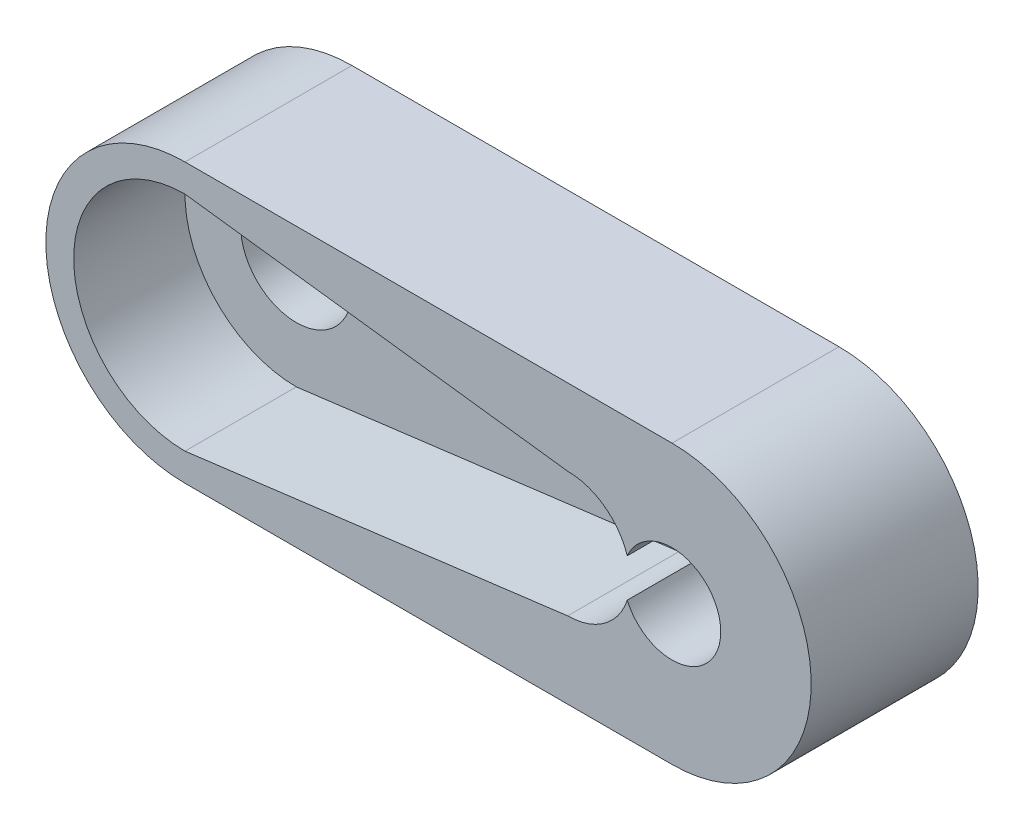
from build123d import *

# Parameters (mm, degrees)
ESQUISSE1_R             = 2
ESQUISSE1_R_2           = 1.75
BOSS_EXTRU_1_DEPTH      = 6
ENL_V_START             = -4
ESQUISSE2_R             = 2
ENL_V_MAT_EXTRU_1_DEPTH = 4
CHANFREIN2_SIZE         = 1.25


with BuildPart() as part:
    # Esquisse1 → Boss.-Extru.1 (new body)
    with BuildSketch(Plane.XY):
        with BuildLine():
            Line((0, 0), (17.5, 0))
            ThreePointArc((17.5, 0), (22.5, 5), (17.5, 10))
            Line((17.5, 10), (0, 10))
            ThreePointArc((0, 10), (-5, 5), (0, 0))
        make_face()
        with Locations((0, 5)):
            Circle(ESQUISSE1_R, mode=Mode.SUBTRACT)
        with Locations((17.5, 5)):
            Circle(ESQUISSE1_R_2, mode=Mode.SUBTRACT)
    extrude(amount=BOSS_EXTRU_1_DEPTH)

    # Esquisse2 → Enlèv. mat.-Extru.1 (cut)
    with BuildSketch(Plane.XY.offset(6).offset(ENL_V_START)):
        with BuildLine():
            Line((1.001951854, 8.872478855), (0, 9))
            ThreePointArc((0, 9), (-4, 5), (0, 1))
            Line((0, 1), (1.001951854, 1.127521145))
            Line((1.001951854, 1.127521145), (13.75, 2.75))
            ThreePointArc((13.75, 2.75), (15.07486756, 3.181421998), (15.891666667, 4.310243602))
            ThreePointArc((15.891666667, 4.310243602), (15.75, 5), (15.891666667, 5.689756398))
            ThreePointArc((15.891666667, 5.689756398), (15.07486756, 6.818578002), (13.75, 7.25))
            Line((13.75, 7.25), (1.001951854, 8.872478855))
        make_face()
        with Locations((0, 5)):
            Circle(ESQUISSE2_R, mode=Mode.SUBTRACT)
    extrude(amount=ENL_V_MAT_EXTRU_1_DEPTH, mode=Mode.SUBTRACT)

    # Chanfrein2
    chanfrein2_edges = [part.edges().sort_by_distance(p)[0] for p in [
        (15.75, 5, 0),
    ]]
    chamfer(chanfrein2_edges, length=CHANFREIN2_SIZE)


solid = part.part
